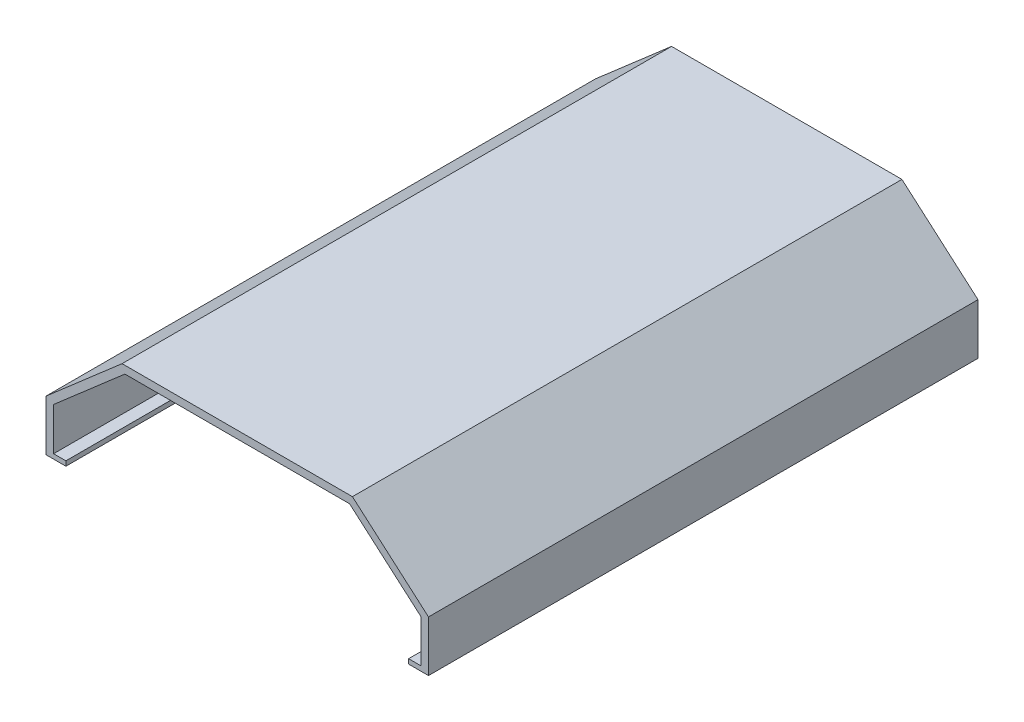
from build123d import *

# Parameters (mm, degrees)
BOSS_EXTRUDE1_DEPTH = 145
BOSS_EXTRUDE2_DEPTH = 7


with BuildPart() as part:
    # Sketch1 → Boss-Extrude1 (new body)
    with BuildSketch(Plane.XY):
        Polygon((2.1, 1.3), (5.5, 1.3), (5.5, 0), (0, 0), (0, 14.057025137), (21.040065237, 32.34687481), (84.759934763, 32.34687481), (105.8, 14.057025137), (105.8, 0), (100.3, 0), (100.3, 1.3), (103.7, 1.3), (103.7, 13.1), (83.974776936, 30.24687481), (21.825223064, 30.24687481), (2.1, 13.1), align=None)
    extrude(amount=BOSS_EXTRUDE1_DEPTH)

    # Sketch2 → Boss-Extrude2 (add)
    with BuildSketch(Plane(origin=(0, 0, 0), x_dir=(-1, 0, 0), z_dir=(0, 0, -1))):
        Polygon((-2.1, 0), (0, 0), (0, 14.057025137), (-21.040065237, 32.34687481), (-84.759934763, 32.34687481), (-105.8, 14.057025137), (-105.8, 0), (-103.7, 0), (-103.7, 13.1), (-83.974776936, 30.24687481), (-21.825223064, 30.24687481), (-2.1, 13.1), align=None)
    extrude(amount=BOSS_EXTRUDE2_DEPTH)


solid = part.part
